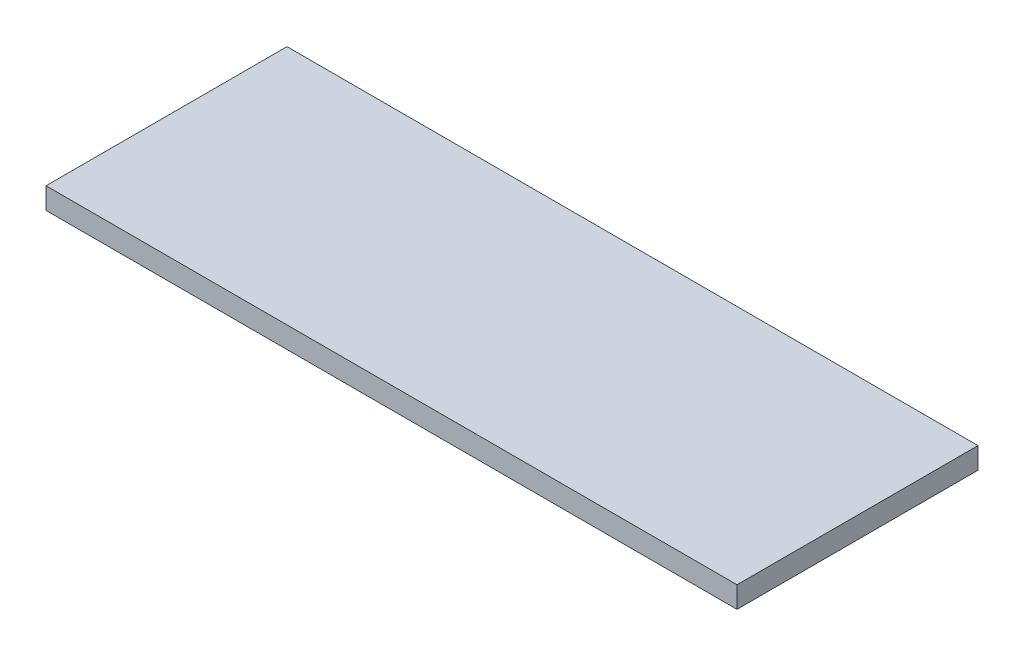
from build123d import *

# Parameters (mm, degrees)
SKETCH1_W           = 31.57
SKETCH1_H           = 11.01
BOSS_EXTRUDE1_DEPTH = 0.974490446


with BuildPart() as part:
    # Sketch1 → Boss-Extrude1 (new body)
    with BuildSketch(Plane(origin=(0, 0, 0), x_dir=(1, 0, 0), z_dir=(0, 1, 0))):
        with Locations((-0.003878505, -0.689719626)):
            Rectangle(SKETCH1_W, SKETCH1_H)
    extrude(amount=BOSS_EXTRUDE1_DEPTH)


solid = part.part
